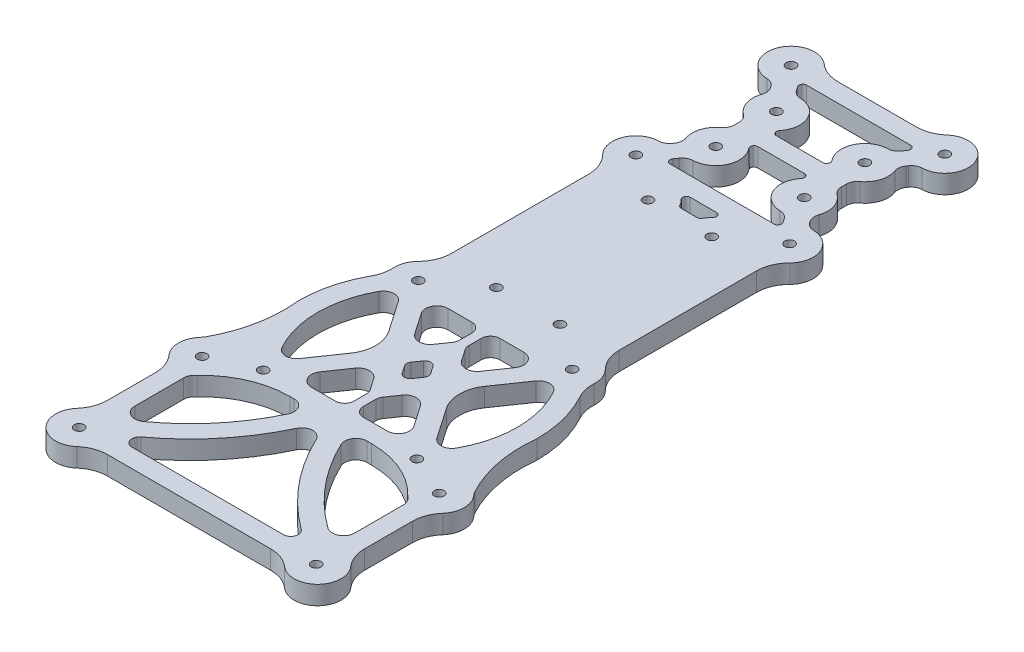
from build123d import *

# Parameters (mm, degrees)
SKETCH1_R           = 1.651
BOSS_EXTRUDE1_DEPTH = 6.35


with BuildPart() as part:
    # Sketch1 → Boss-Extrude1 (new body)
    with BuildSketch(Plane(origin=(0, 0, 0), x_dir=(1, 0, 0), z_dir=(0, 1, 0))):
        with BuildLine():
            Line((-28.575, -23.384226267), (-28.575, 23.384226267))
            ThreePointArc((-28.575, 23.384226267), (-29.434698415, 27.733205965), (-31.884470588, 31.427975522))
            ThreePointArc((-31.884470588, 31.427975522), (-33.628839941, 40.030101959), (-26.433167956, 45.056204662))
            ThreePointArc((-26.433167956, 45.056204662), (-24.723775263, 45.517600234), (-23.407512822, 46.701814083))
            Line((-23.407512822, 46.701814083), (-23.107920302, 47.136308835))
            ThreePointArc((-23.107920302, 47.136308835), (-22.469049266, 48.787597136), (-22.645540765, 50.549346268))
            ThreePointArc((-22.645540765, 50.549346268), (-22.726910762, 55.553330592), (-19.819374194, 59.626745781))
            ThreePointArc((-19.819374194, 59.626745781), (-18.674005414, 60.976945622), (-18.2626, 62.699053296))
            Line((-18.2626, 62.699053296), (-18.2626, 64.300946704))
            ThreePointArc((-18.2626, 64.300946704), (-18.674005414, 66.023054378), (-19.819374194, 67.373254219))
            ThreePointArc((-19.819374194, 67.373254219), (-22.726910762, 71.446669408), (-22.645540765, 76.450653732))
            ThreePointArc((-22.645540765, 76.450653732), (-22.469049266, 78.212402864), (-23.107920302, 79.863691165))
            Line((-23.107920302, 79.863691165), (-23.407512822, 80.298185917))
            ThreePointArc((-23.407512822, 80.298185917), (-24.723775263, 81.482399766), (-26.433167956, 81.943795338))
            ThreePointArc((-26.433167956, 81.943795338), (-33.64597852, 92.869692006), (-20.922796943, 95.955223529))
            ThreePointArc((-20.922796943, 95.955223529), (-17.411679921, 93.849623685), (-13.383792575, 93.1164))
            Line((-13.383792575, 93.1164), (13.383792575, 93.1164))
            ThreePointArc((13.383792575, 93.1164), (17.411679921, 93.849623685), (20.922796943, 95.955223529))
            ThreePointArc((20.922796943, 95.955223529), (33.64597852, 92.869692006), (26.433167956, 81.943795338))
            ThreePointArc((26.433167956, 81.943795338), (24.723775263, 81.482399766), (23.407512822, 80.298185917))
            Line((23.407512822, 80.298185917), (23.107920302, 79.863691165))
            ThreePointArc((23.107920302, 79.863691165), (22.469049266, 78.212402864), (22.645540765, 76.450653732))
            ThreePointArc((22.645540765, 76.450653732), (22.726910762, 71.446669408), (19.819374194, 67.373254219))
            ThreePointArc((19.819374194, 67.373254219), (18.674005414, 66.023054378), (18.2626, 64.300946704))
            Line((18.2626, 64.300946704), (18.2626, 62.699053296))
            ThreePointArc((18.2626, 62.699053296), (18.674005414, 60.976945622), (19.819374194, 59.626745781))
            ThreePointArc((19.819374194, 59.626745781), (22.726910762, 55.553330592), (22.645540765, 50.549346268))
            ThreePointArc((22.645540765, 50.549346268), (22.469049266, 48.787597136), (23.107920302, 47.136308835))
            Line((23.107920302, 47.136308835), (23.407512822, 46.701814083))
            ThreePointArc((23.407512822, 46.701814083), (24.723775263, 45.517600234), (26.433167956, 45.056204662))
            ThreePointArc((26.433167956, 45.056204662), (33.628839941, 40.030101959), (31.884470588, 31.427975522))
            ThreePointArc((31.884470588, 31.427975522), (29.434698415, 27.733205965), (28.575, 23.384226267))
            Line((28.575, 23.384226267), (28.575, -23.384226267))
            ThreePointArc((28.575, -23.384226267), (29.434698415, -27.733205965), (31.884470588, -31.427975522))
            ThreePointArc((31.884470588, -31.427975522), (33.685481845, -34.232815218), (34.187312674, -37.528104748))
            ThreePointArc((34.187312674, -37.528104748), (34.450175778, -40.724586196), (35.590755192, -43.722196789))
            ThreePointArc((35.590755192, -43.722196789), (39.392211703, -53.288123128), (40.686657183, -63.5))
            ThreePointArc((40.686657183, -63.5), (41.185239403, -77.002793747), (45.731452758, -89.727021321))
            ThreePointArc((45.731452758, -89.727021321), (46.125106431, -90.361769617), (46.590568738, -90.945904407))
            ThreePointArc((46.590568738, -90.945904407), (48.638147494, -96.245808425), (46.65110092, -101.568703057))
            ThreePointArc((46.65110092, -101.568703057), (44.545501075, -105.079820079), (43.81227739, -109.107707425))
            Line((43.81227739, -109.107707425), (43.81227739, -125.385092575))
            ThreePointArc((43.81227739, -125.385092575), (44.545501075, -129.412979921), (46.65110092, -132.924096943))
            ThreePointArc((46.65110092, -132.924096943), (46.294838747, -143.858961356), (35.359974333, -144.215223529))
            ThreePointArc((35.359974333, -144.215223529), (31.848857312, -142.109623685), (27.820969966, -141.3764))
            Line((27.820969966, -141.3764), (-27.820969966, -141.3764))
            ThreePointArc((-27.820969966, -141.3764), (-31.848857312, -142.109623685), (-35.359974333, -144.215223529))
            ThreePointArc((-35.359974333, -144.215223529), (-46.294838747, -143.858961356), (-46.65110092, -132.924096943))
            ThreePointArc((-46.65110092, -132.924096943), (-44.545501075, -129.412979921), (-43.81227739, -125.385092575))
            Line((-43.81227739, -125.385092575), (-43.81227739, -109.107707425))
            ThreePointArc((-43.81227739, -109.107707425), (-44.545501075, -105.079820079), (-46.65110092, -101.568703057))
            ThreePointArc((-46.65110092, -101.568703057), (-48.638147494, -96.245808425), (-46.590568738, -90.945904407))
            ThreePointArc((-46.590568738, -90.945904407), (-46.125106431, -90.361769617), (-45.731452758, -89.727021321))
            ThreePointArc((-45.731452758, -89.727021321), (-41.185239403, -77.002793747), (-40.686657183, -63.5))
            ThreePointArc((-40.686657183, -63.5), (-39.392211703, -53.288123128), (-35.590755192, -43.722196789))
            ThreePointArc((-35.590755192, -43.722196789), (-34.450175778, -40.724586196), (-34.187312674, -37.528104748))
            ThreePointArc((-34.187312674, -37.528104748), (-33.685481845, -34.232815218), (-31.884470588, -31.427975522))
            ThreePointArc((-31.884470588, -31.427975522), (-29.434698415, -27.733205965), (-28.575, -23.384226267))
        make_face()
        with Locations(Location((-10.8458, 25.8445, 0), (0, 0, 270))):
            Circle(SKETCH1_R, mode=Mode.SUBTRACT)
        with Locations(Location((10.8458, 25.8445, 0), (0, 0, 270))):
            Circle(SKETCH1_R, mode=Mode.SUBTRACT)
        with Locations(Location((-10.8458, -25.8445, 0), (0, 0, 270))):
            Circle(SKETCH1_R, mode=Mode.SUBTRACT)
        with Locations(Location((10.8458, -25.8445, 0), (0, 0, 270))):
            Circle(SKETCH1_R, mode=Mode.SUBTRACT)
        with Locations(Location((-15.0876, 73.8251, 0), (0, 0, 270))):
            Circle(SKETCH1_R, mode=Mode.SUBTRACT)
        with Locations(Location((15.0876, 73.8251, 0), (0, 0, 270))):
            Circle(SKETCH1_R, mode=Mode.SUBTRACT)
        with Locations(Location((-15.0876, 53.1749, 0), (0, 0, 270))):
            Circle(SKETCH1_R, mode=Mode.SUBTRACT)
        with Locations(Location((15.0876, 53.1749, 0), (0, 0, 270))):
            Circle(SKETCH1_R, mode=Mode.SUBTRACT)
        with Locations(Location((-26.2001, 89.9414, 0), (0, 0, 270))):
            Circle(SKETCH1_R, mode=Mode.SUBTRACT)
        with Locations(Location((26.2001, 89.9414, 0), (0, 0, 270))):
            Circle(SKETCH1_R, mode=Mode.SUBTRACT)
        with Locations(Location((26.2001, 37.0586, 0), (0, 0, 270))):
            Circle(SKETCH1_R, mode=Mode.SUBTRACT)
        with Locations(Location((-26.2001, 37.0586, 0), (0, 0, 270))):
            Circle(SKETCH1_R, mode=Mode.SUBTRACT)
        with Locations(Location((26.2001, -89.9414, 0), (0, 0, 270))):
            Circle(SKETCH1_R, mode=Mode.SUBTRACT)
        with Locations(Location((-26.2001, -89.9414, 0), (0, 0, 270))):
            Circle(SKETCH1_R, mode=Mode.SUBTRACT)
        with Locations(Location((-26.2001, -37.0586, 0), (0, 0, 270))):
            Circle(SKETCH1_R, mode=Mode.SUBTRACT)
        with Locations(Location((26.2001, -37.0586, 0), (0, 0, 270))):
            Circle(SKETCH1_R, mode=Mode.SUBTRACT)
        with Locations(Location((-40.63727739, -96.2914, 0), (0, 0, 270))):
            Circle(SKETCH1_R, mode=Mode.SUBTRACT)
        with Locations(Location((40.13472261, -96.2914, 0), (0, 0, 270))):
            Circle(SKETCH1_R, mode=Mode.SUBTRACT)
        with Locations(Location((40.13472261, -138.2014, 0), (0, 0, 270))):
            Circle(SKETCH1_R, mode=Mode.SUBTRACT)
        with Locations(Location((-40.63727739, -138.2014, 0), (0, 0, 270))):
            Circle(SKETCH1_R, mode=Mode.SUBTRACT)
        with BuildLine():
            Line((-16.298662089, -57.011678747), (-23.440673263, -46.65372197))
            ThreePointArc((-23.440673263, -46.65372197), (-26.666194975, -45.060744799), (-29.717784377, -46.965835008))
            ThreePointArc((-29.717784377, -46.965835008), (-33.977486488, -63.5), (-29.717784377, -80.034164992))
            ThreePointArc((-29.717784377, -80.034164992), (-26.666194975, -81.939255201), (-23.440673263, -80.34627803))
            Line((-23.440673263, -80.34627803), (-16.298662089, -69.988321253))
            ThreePointArc((-16.298662089, -69.988321253), (-14.278581712, -63.5), (-16.298662089, -57.011678747))
        make_face(mode=Mode.SUBTRACT)
        with BuildLine():
            Line((-18.781500154, 84.775475416), (-17.880187178, 83.468314083))
            ThreePointArc((-17.880187178, 83.468314083), (-16.563924737, 82.284100234), (-14.854532044, 81.822704662))
            ThreePointArc((-14.854532044, 81.822704662), (-7.806033659, 77.140939655), (-8.901780222, 68.750493151))
            ThreePointArc((-8.901780222, 68.750493151), (-9.067918941, 67.401896097), (-7.919904067, 66.675))
            Line((-7.919904067, 66.675), (7.919904067, 66.675))
            ThreePointArc((7.919904067, 66.675), (9.067918941, 67.401896097), (8.901780222, 68.750493151))
            ThreePointArc((8.901780222, 68.750493151), (7.806033659, 77.140939655), (14.854532044, 81.822704662))
            ThreePointArc((14.854532044, 81.822704662), (16.563924737, 82.284100234), (17.880187178, 83.468314083))
            Line((17.880187178, 83.468314083), (18.781500154, 84.775475416))
            ThreePointArc((18.781500154, 84.775475416), (18.86033652, 86.086876832), (17.735953529, 86.7664))
            Line((17.735953529, 86.7664), (-17.735953529, 86.7664))
            ThreePointArc((-17.735953529, 86.7664), (-18.86033652, 86.086876832), (-18.781500154, 84.775475416))
        make_face(mode=Mode.SUBTRACT)
        with BuildLine():
            Line((-7.919904067, 60.325), (7.919904067, 60.325))
            ThreePointArc((7.919904067, 60.325), (9.067918941, 59.598103903), (8.901780222, 58.249506849))
            ThreePointArc((8.901780222, 58.249506849), (7.806033659, 49.859060345), (14.854532044, 45.177295338))
            ThreePointArc((14.854532044, 45.177295338), (16.563924737, 44.715899766), (17.880187178, 43.531685917))
            Line((17.880187178, 43.531685917), (18.781500154, 42.224524584))
            ThreePointArc((18.781500154, 42.224524584), (18.86033652, 40.913123168), (17.735953529, 40.2336))
            Line((17.735953529, 40.2336), (-17.735953529, 40.2336))
            ThreePointArc((-17.735953529, 40.2336), (-18.86033652, 40.913123168), (-18.781500154, 42.224524584))
            Line((-18.781500154, 42.224524584), (-17.880187178, 43.531685917))
            ThreePointArc((-17.880187178, 43.531685917), (-16.563924737, 44.715899766), (-14.854532044, 45.177295338))
            ThreePointArc((-14.854532044, 45.177295338), (-7.806033659, 49.859060345), (-8.901780222, 58.249506849))
            ThreePointArc((-8.901780222, 58.249506849), (-9.067918941, 59.598103903), (-7.919904067, 60.325))
        make_face(mode=Mode.SUBTRACT)
        with BuildLine():
            Line((-4.470450598, 33.8455), (4.470450598, 33.8455))
            ThreePointArc((4.470450598, 33.8455), (5.650261936, 33.045548088), (5.343786132, 31.653445205))
            ThreePointArc((5.343786132, 31.653445205), (4.506861117, 30.726492916), (3.824377828, 29.68059589))
            ThreePointArc((3.824377828, 29.68059589), (3.357782949, 29.197206949), (2.709866372, 29.0195))
            Line((2.709866372, 29.0195), (-2.709866372, 29.0195))
            ThreePointArc((-2.709866372, 29.0195), (-3.357782949, 29.197206949), (-3.824377828, 29.68059589))
            ThreePointArc((-3.824377828, 29.68059589), (-4.506861117, 30.726492916), (-5.343786132, 31.653445205))
            ThreePointArc((-5.343786132, 31.653445205), (-5.650261936, 33.045548088), (-4.470450598, 33.8455))
        make_face(mode=Mode.SUBTRACT)
        with BuildLine():
            Line((-11.104884082, -53.357811206), (-16.035938277, -46.206373751))
            ThreePointArc((-16.035938277, -46.206373751), (-16.272447376, -42.272169503), (-12.899298403, -40.2336))
            Line((-12.899298403, -40.2336), (-4.768681329, -40.2336))
            ThreePointArc((-4.768681329, -40.2336), (-2.519246439, -41.165346439), (-1.5875, -43.414781329))
            Line((-1.5875, -43.414781329), (-1.5875, -47.662500884))
            ThreePointArc((-1.5875, -47.662500884), (-1.731306906, -48.608160051), (-2.149725895, -49.468321219))
            Line((-2.149725895, -49.468321219), (-4.831604334, -53.357811206))
            ThreePointArc((-4.831604334, -53.357811206), (-7.968244208, -55.005037455), (-11.104884082, -53.357811206))
        make_face(mode=Mode.SUBTRACT)
        with BuildLine():
            Line((-3.346467102, -62.390267481), (-1.609429218, -59.871066254))
            ThreePointArc((-1.609429218, -59.871066254), (0, -59.025864331), (1.609429218, -59.871066254))
            Line((1.609429218, -59.871066254), (3.346467102, -62.390267481))
            ThreePointArc((3.346467102, -62.390267481), (3.691972325, -63.5), (3.346467102, -64.609732519))
            Line((3.346467102, -64.609732519), (1.609429218, -67.128933746))
            ThreePointArc((1.609429218, -67.128933746), (0, -67.974135669), (-1.609429218, -67.128933746))
            Line((-1.609429218, -67.128933746), (-3.346467102, -64.609732519))
            ThreePointArc((-3.346467102, -64.609732519), (-3.691972325, -63.5), (-3.346467102, -62.390267481))
        make_face(mode=Mode.SUBTRACT)
        with BuildLine():
            Line((1.5875, -43.414781329), (1.5875, -47.662500884))
            ThreePointArc((1.5875, -47.662500884), (1.731306906, -48.608160051), (2.149725895, -49.468321219))
            Line((2.149725895, -49.468321219), (4.831604334, -53.357811206))
            ThreePointArc((4.831604334, -53.357811206), (7.968244208, -55.005037455), (11.104884082, -53.357811206))
            Line((11.104884082, -53.357811206), (16.035938277, -46.206373751))
            ThreePointArc((16.035938277, -46.206373751), (16.272447376, -42.272169503), (12.899298403, -40.2336))
            Line((12.899298403, -40.2336), (4.768681329, -40.2336))
            ThreePointArc((4.768681329, -40.2336), (2.519246439, -41.165346439), (1.5875, -43.414781329))
        make_face(mode=Mode.SUBTRACT)
        with BuildLine():
            Line((-1.5875, -83.585218671), (-1.5875, -79.337499116))
            ThreePointArc((-1.5875, -79.337499116), (-1.731306906, -78.391839949), (-2.149725895, -77.531678781))
            Line((-2.149725895, -77.531678781), (-4.831604334, -73.642188794))
            ThreePointArc((-4.831604334, -73.642188794), (-7.968244208, -71.994962545), (-11.104884082, -73.642188794))
            Line((-11.104884082, -73.642188794), (-16.035938277, -80.793626249))
            ThreePointArc((-16.035938277, -80.793626249), (-16.272447376, -84.727830497), (-12.899298403, -86.7664))
            Line((-12.899298403, -86.7664), (-4.768681329, -86.7664))
            ThreePointArc((-4.768681329, -86.7664), (-2.519246439, -85.834653561), (-1.5875, -83.585218671))
        make_face(mode=Mode.SUBTRACT)
        with BuildLine():
            Line((-13.906181716, -93.148579741), (-12.452375003, -93.148579741))
            ThreePointArc((-12.452375003, -93.148579741), (-9.233457759, -94.920278542), (-9.008216013, -98.587649675))
            ThreePointArc((-9.008216013, -98.587649675), (-18.50818656, -113.465878493), (-31.428640047, -125.493888091))
            ThreePointArc((-31.428640047, -125.493888091), (-35.39067345, -125.790389921), (-37.46227739, -122.400098026))
            Line((-37.46227739, -122.400098026), (-37.46227739, -105.815553296))
            ThreePointArc((-37.46227739, -105.815553296), (-37.050871977, -104.093445622), (-35.905503197, -102.743245781))
            ThreePointArc((-35.905503197, -102.743245781), (-25.9064709, -95.651601867), (-13.906181716, -93.148579741))
        make_face(mode=Mode.SUBTRACT)
        with BuildLine():
            Line((16.035938277, -80.793626249), (11.104884082, -73.642188794))
            ThreePointArc((11.104884082, -73.642188794), (7.968244208, -71.994962545), (4.831604334, -73.642188794))
            Line((4.831604334, -73.642188794), (2.149725895, -77.531678781))
            ThreePointArc((2.149725895, -77.531678781), (1.731306906, -78.391839949), (1.5875, -79.337499116))
            Line((1.5875, -79.337499116), (1.5875, -83.585218671))
            ThreePointArc((1.5875, -83.585218671), (2.519246439, -85.834653561), (4.768681329, -86.7664))
            Line((4.768681329, -86.7664), (12.899298403, -86.7664))
            ThreePointArc((12.899298403, -86.7664), (16.272447376, -84.727830497), (16.035938277, -80.793626249))
        make_face(mode=Mode.SUBTRACT)
        with BuildLine():
            Line((23.440673263, -80.34627803), (16.298662089, -69.988321253))
            ThreePointArc((16.298662089, -69.988321253), (14.278581712, -63.5), (16.298662089, -57.011678747))
            Line((16.298662089, -57.011678747), (23.440673263, -46.65372197))
            ThreePointArc((23.440673263, -46.65372197), (26.666194975, -45.060744799), (29.717784377, -46.965835008))
            ThreePointArc((29.717784377, -46.965835008), (33.977486488, -63.5), (29.717784377, -80.034164992))
            ThreePointArc((29.717784377, -80.034164992), (26.666194975, -81.939255201), (23.440673263, -80.34627803))
        make_face(mode=Mode.SUBTRACT)
        with BuildLine():
            Line((-25.779558234, -135.0264), (25.779558234, -135.0264))
            ThreePointArc((25.779558234, -135.0264), (28.193802462, -133.275719205), (27.280038024, -130.436970714))
            ThreePointArc((27.280038024, -130.436970714), (13.480498783, -117.410382633), (3.320502988, -101.382476789))
            ThreePointArc((3.320502988, -101.382476789), (0, -99.276454663), (-3.320502988, -101.382476789))
            ThreePointArc((-3.320502988, -101.382476789), (-13.480498783, -117.410382633), (-27.280038024, -130.436970714))
            ThreePointArc((-27.280038024, -130.436970714), (-28.193802462, -133.275719205), (-25.779558234, -135.0264))
        make_face(mode=Mode.SUBTRACT)
        with BuildLine():
            Line((37.46227739, -122.400098026), (37.46227739, -105.815553296))
            ThreePointArc((37.46227739, -105.815553296), (37.050871977, -104.093445622), (35.905503197, -102.743245781))
            ThreePointArc((35.905503197, -102.743245781), (25.9064709, -95.651601867), (13.906181716, -93.148579741))
            Line((13.906181716, -93.148579741), (12.452375003, -93.148579741))
            ThreePointArc((12.452375003, -93.148579741), (9.233457759, -94.920278542), (9.008216013, -98.587649675))
            ThreePointArc((9.008216013, -98.587649675), (18.50818656, -113.465878493), (31.428640047, -125.493888091))
            ThreePointArc((31.428640047, -125.493888091), (35.39067345, -125.790389921), (37.46227739, -122.400098026))
        make_face(mode=Mode.SUBTRACT)
    extrude(amount=-BOSS_EXTRUDE1_DEPTH)


solid = part.part
